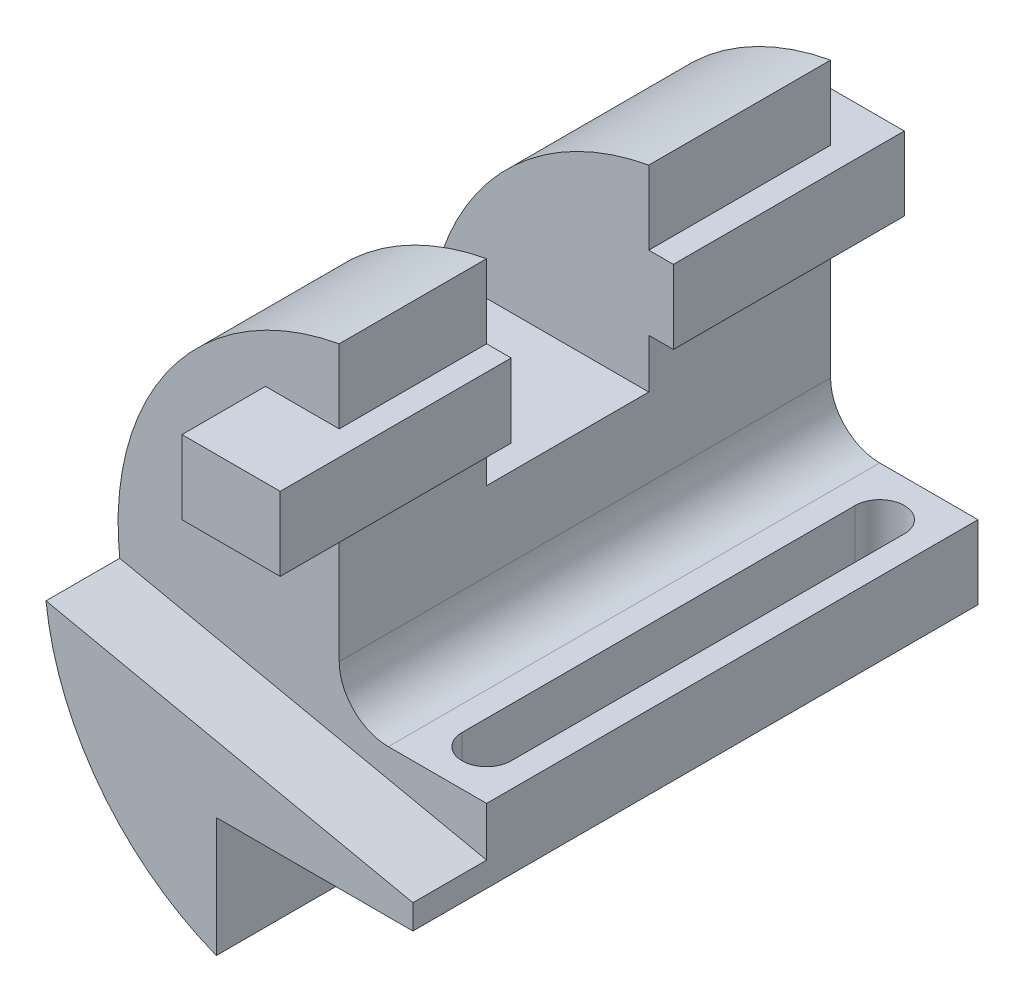
from build123d import *

# Parameters (mm, degrees)
BOSS_EXTRUDE1_DEPTH      = 115
CUT_EXTRUDE1_START       = -15
CUT_EXTRUDE1_DEPTH       = 15
CUT_EXTRUDE2_DEPTH       = 58
SKETCH6_W                = 33
SKETCH6_H                = 40
CUT_EXTRUDE3_DEPTH       = 58
BOSS_EXTRUDE2_DEPTH      = 5
BOSS_EXTRUDE2_DEPTH_BACK = 15
SKETCH7_W                = 47
SKETCH7_H                = 15
BOSS_EXTRUDE3_DEPTH      = 5
BOSS_EXTRUDE3_DEPTH_BACK = 15
SKETCH8_W                = 47
SKETCH8_H                = 15


with BuildPart() as part:
    # Sketch2 → Boss-Extrude1 (new body)
    with BuildSketch(Plane.XY):
        with BuildLine():
            Line((-20, -51.23475383), (-20, -26.916730868))
            Line((-20, -26.916730868), (20, -26.916730868))
            Line((20, -26.916730868), (20, -11.916730868))
            Line((20, -11.916730868), (0, -11.916730868))
            ThreePointArc((0, -11.916730868), (-7.071067812, -8.98779868), (-10, -1.916730868))
            Line((-10, -1.916730868), (-10, 54.083269132))
            ThreePointArc((-10, 54.083269132), (-54.753734942, 5.198895061), (-20, -51.23475383))
        make_face()
    extrude(amount=BOSS_EXTRUDE1_DEPTH)

    # Sketch3 → Cut-Extrude1 (cut)
    with BuildSketch(Plane.XY.offset(115).offset(CUT_EXTRUDE1_START)):
        with BuildLine():
            Line((-54.666698166, -6.045834235), (20, -21.916730868))
            Line((20, -21.916730868), (20, -11.916730868))
            Line((20, -11.916730868), (0, -11.916730868))
            ThreePointArc((0, -11.916730868), (-7.071067812, -8.98779868), (-10, -1.916730868))
            Line((-10, -1.916730868), (-10, 54.083269132))
            ThreePointArc((-10, 54.083269132), (-44.151135103, 32.797519253), (-54.666698166, -6.045834235))
        make_face()
    extrude(amount=CUT_EXTRUDE1_DEPTH, mode=Mode.SUBTRACT)

    # Sketch4 → Cut-Extrude2 (cut)
    with BuildSketch(Plane(origin=(0, -11.916730868, 0), x_dir=(1, 0, 0), z_dir=(0, 1, 0))):
        with BuildLine():
            Line((15, -10), (15, -90))
            ThreePointArc((15, -90), (10, -95), (5, -90))
            Line((5, -90), (5, -10))
            ThreePointArc((5, -10), (10, -5), (15, -10))
        make_face()
    extrude(amount=-CUT_EXTRUDE2_DEPTH, mode=Mode.SUBTRACT)

    # Sketch6 → Cut-Extrude3 (cut)
    with BuildSketch(Plane(origin=(-10, 0, 0), x_dir=(0, 0, -1), z_dir=(1, 0, 0))):
        with Locations((-53.5, 34.083269132)):
            Rectangle(SKETCH6_W, SKETCH6_H)
    extrude(amount=-CUT_EXTRUDE3_DEPTH, mode=Mode.SUBTRACT)

    # Sketch7 → Boss-Extrude2 (add, two sides: drawn at the far end of the back side and taken through both)
    with BuildSketch(Plane(origin=(-10, 0, 0), x_dir=(0, 0, -1), z_dir=(1, 0, 0)).offset(-BOSS_EXTRUDE2_DEPTH_BACK)):
        with Locations((-13.5, 31.583269132)):
            Rectangle(SKETCH7_W, SKETCH7_H)
    extrude(amount=BOSS_EXTRUDE2_DEPTH + BOSS_EXTRUDE2_DEPTH_BACK)

    # Sketch8 → Boss-Extrude3 (add, two sides: drawn at the far end of the back side and taken through both)
    with BuildSketch(Plane(origin=(-10, 0, 0), x_dir=(0, 0, -1), z_dir=(1, 0, 0)).offset(-BOSS_EXTRUDE3_DEPTH_BACK)):
        with Locations((-93.5, 31.583269132)):
            Rectangle(SKETCH8_W, SKETCH8_H)
    extrude(amount=BOSS_EXTRUDE3_DEPTH + BOSS_EXTRUDE3_DEPTH_BACK)


solid = part.part
